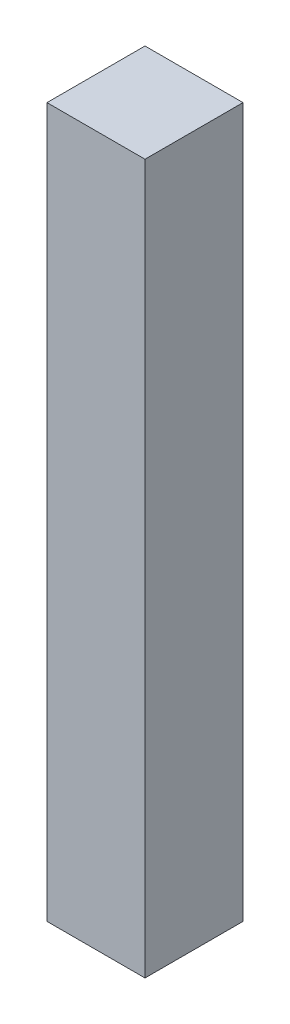
from build123d import *

# Parameters (mm, degrees)
SKETCH1_W           = 30
SKETCH1_H           = 30
BOSS_EXTRUDE1_DEPTH = 217


with BuildPart() as part:
    # Sketch1 → Boss-Extrude1 (new body)
    with BuildSketch(Plane(origin=(0, 0, 0), x_dir=(1, 0, 0), z_dir=(0, 1, 0))):
        with Locations((-21.055045872, -9.729357798)):
            Rectangle(SKETCH1_W, SKETCH1_H)
    extrude(amount=BOSS_EXTRUDE1_DEPTH)


solid = part.part
